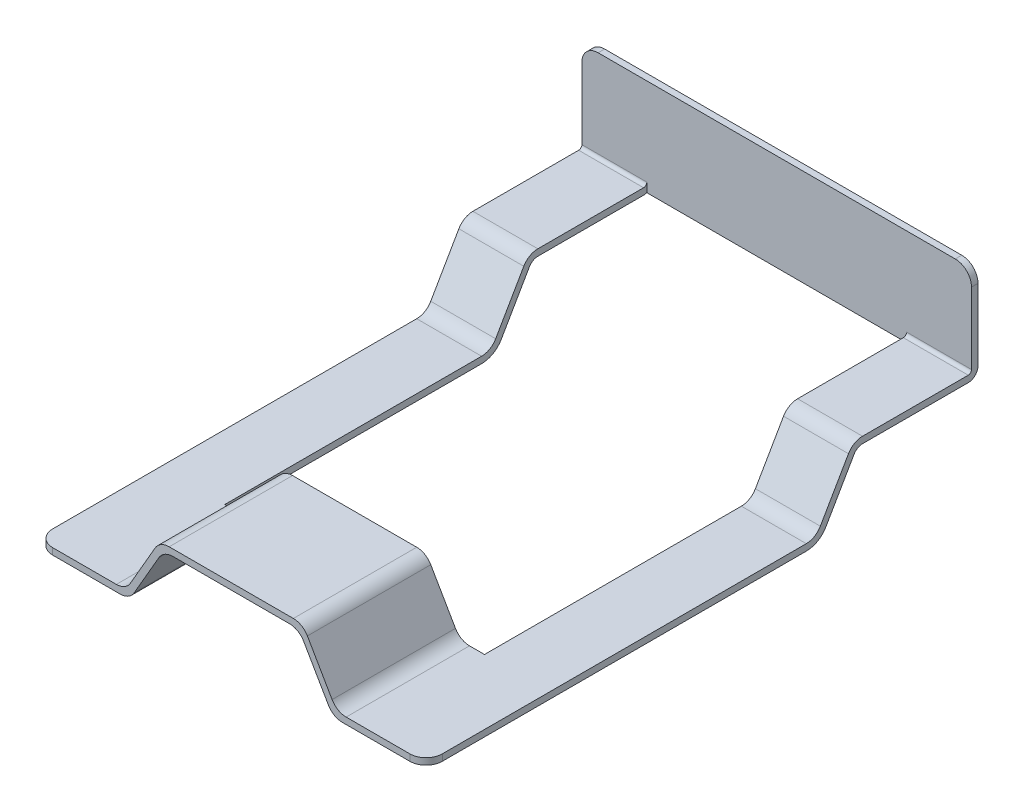
from build123d import *

# Parameters (mm, degrees)
BOSS_EXTRUDE1_DEPTH     = 1524
CUT_EXTRUDE1_DEPTH      = 4739.580867728
CUT_EXTRUDE1_DEPTH_BACK = 4739.580867728
SKETCH2_W               = 2032
SKETCH2_H               = 3302
BOSS_EXTRUDE2_DEPTH     = 965.2
CUT_EXTRUDE2_REACH      = 4740.581
FILLET1_R               = 127
FILLET2_R               = 127


with BuildPart() as part:
    # Sketch1 → Boss-Extrude1 (new, symmetric)
    with BuildSketch(Plane(origin=(0, 0, 0), x_dir=(0, 0, -1), z_dir=(1, 0, 0))):
        with BuildLine():
            Line((0, 0), (2974.676515813, 0))
            ThreePointArc((2974.676515813, 0), (3038.176515813, 17.014773719), (3084.661742094, 63.5))
            Line((3084.661742094, 63.5), (3304.632194655, 444.5))
            ThreePointArc((3304.632194655, 444.5), (3351.117420935, 490.985226281), (3414.617420935, 508))
            Line((3414.617420935, 508), (4241.8, 508))
            ThreePointArc((4241.8, 508), (4259.760512242, 515.439487758), (4267.2, 533.4))
            Line((4267.2, 533.4), (4267.2, 1219.2))
            Line((4267.2, 1219.2), (4318, 1219.2))
            Line((4318, 1219.2), (4318, 533.4))
            ThreePointArc((4318, 533.4), (4295.681536726, 479.518463274), (4241.8, 457.2))
            Line((4241.8, 457.2), (3414.617420935, 457.2))
            ThreePointArc((3414.617420935, 457.2), (3376.517420935, 446.991135768), (3348.626285167, 419.1))
            Line((3348.626285167, 419.1), (3128.655832606, 38.1))
            ThreePointArc((3128.655832606, 38.1), (3063.576515813, -26.979316793), (2974.676515813, -50.8))
            Line((2974.676515813, -50.8), (0, -50.8))
            Line((0, -50.8), (0, 0))
        make_face()
    extrude(amount=BOSS_EXTRUDE1_DEPTH, both=True)

    # Sketch2 → Cut-Extrude1 (cut, two sides: drawn at the far end of the back side and taken through both)
    with BuildSketch(Plane(origin=(0, 0, 0), x_dir=(1, 0, 0), z_dir=(0, 1, 0)).offset(-CUT_EXTRUDE1_DEPTH_BACK)):
        with Locations((0, 2616.2)):
            Rectangle(SKETCH2_W, SKETCH2_H)
    extrude(amount=CUT_EXTRUDE1_DEPTH + CUT_EXTRUDE1_DEPTH_BACK, mode=Mode.SUBTRACT)

    # Sketch3 → Boss-Extrude2 (add)
    with BuildSketch(Plane.XY):
        Polygon((-825.5, 0), (-559.019392725, 461.557951031), (559.019392725, 461.557951031), (825.5, 0), (766.84121265, 0), (529.689999051, 410.757951031), (-529.689999051, 410.757951031), (-766.84121265, 0), align=None)
    extrude(amount=-BOSS_EXTRUDE2_DEPTH)

    # Sketch4 → Cut-Extrude2 (cut, up to next)
    with BuildSketch(Plane.XY, mode=Mode.PRIVATE) as cut_extrude2_sk1:
        Polygon((-766.84121265, 0), (-796.170606325, -50.8), (796.170606325, -50.8), (766.84121265, 0), align=None)
    cut_extrude2_tool1 = extrude(cut_extrude2_sk1.sketch, amount=-CUT_EXTRUDE2_REACH, mode=Mode.PRIVATE) & part.part
    add(cut_extrude2_tool1.solids().sort_by_distance((0, -25.558874, 0))[0], mode=Mode.SUBTRACT)

    # Fillet1
    fillet1_edges = [part.edges().sort_by_distance(p)[0] for p in [
        (-825.5, 0, -482.6),
        (-559.019392725, 461.557951031, -482.6),
        (559.019392725, 461.557951031, -482.6),
        (825.5, 0, -482.6),
        (529.689999051, 410.757951031, -482.6),
        (-529.689999051, 410.757951031, -482.6),
        (796.170606325, -50.8, -482.6),
        (-796.170606325, -50.8, -482.6),
    ]]
    fillet(fillet1_edges, radius=FILLET1_R)

    # Fillet2
    fillet2_edges = [part.edges().sort_by_distance(p)[0] for p in [
        (-1524, 1219.2, -4292.6),
        (-1524, -25.4, 0),
        (1524, 1219.2, -4292.6),
        (1524, -25.4, 0),
    ]]
    fillet(fillet2_edges, radius=FILLET2_R)


solid = part.part
